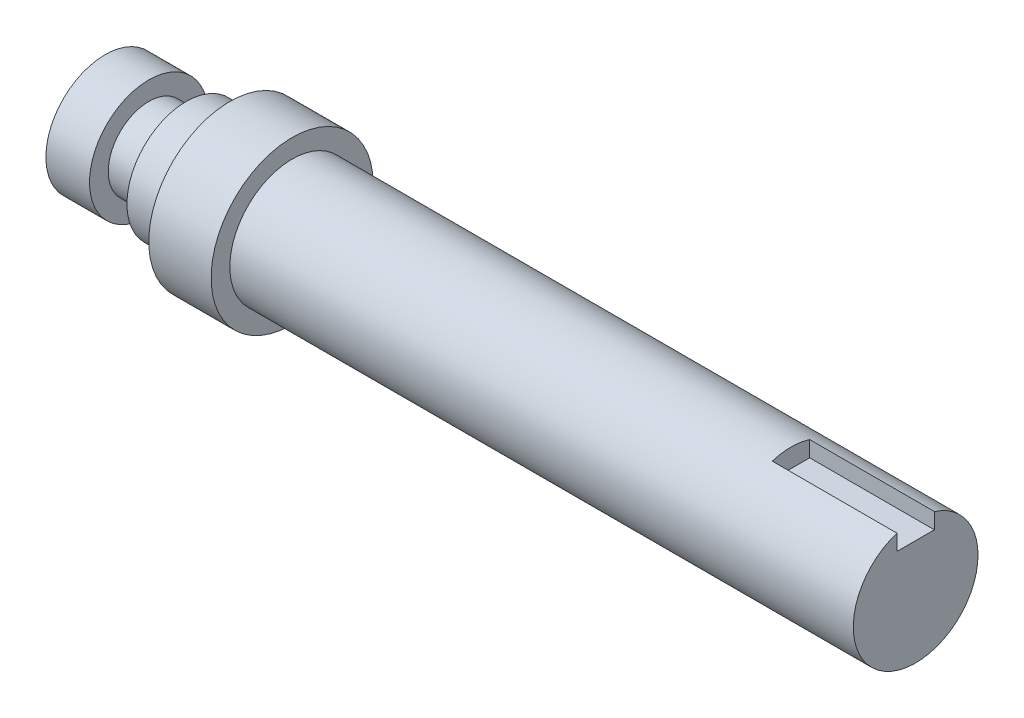
from build123d import *

# Parameters (mm, degrees)
SKETCH4_W          = 508
SKETCH4_H          = 127
CUT_EXTRUDE1_DEPTH = 76.2


with BuildPart() as part:
    # Sketch1 → Revolve1 (revolve)
    with BuildSketch(Plane(origin=(0, 0, 0), x_dir=(1, 0, 0), z_dir=(0, 1, 0))):
        Polygon((0, 0), (-3302, 0), (-3302, 241.3), (-3124.2, 241.3), (-3124.2, 165.1), (-2971.8, 165.1), (-2971.8, 241.3), (-2794, 241.3), (-2794, 330.2), (-2540, 330.2), (-2540, 254), (0, 254), align=None)
    revolve(axis=Axis((0, 0, 0), (-1, 0, 0)))

    # Sketch4 → Cut-Extrude1 (cut, symmetric)
    with BuildSketch(Plane.XY):
        with Locations((-254, 241.3)):
            Rectangle(SKETCH4_W, SKETCH4_H)
    extrude(amount=CUT_EXTRUDE1_DEPTH, both=True, mode=Mode.SUBTRACT)


solid = part.part
